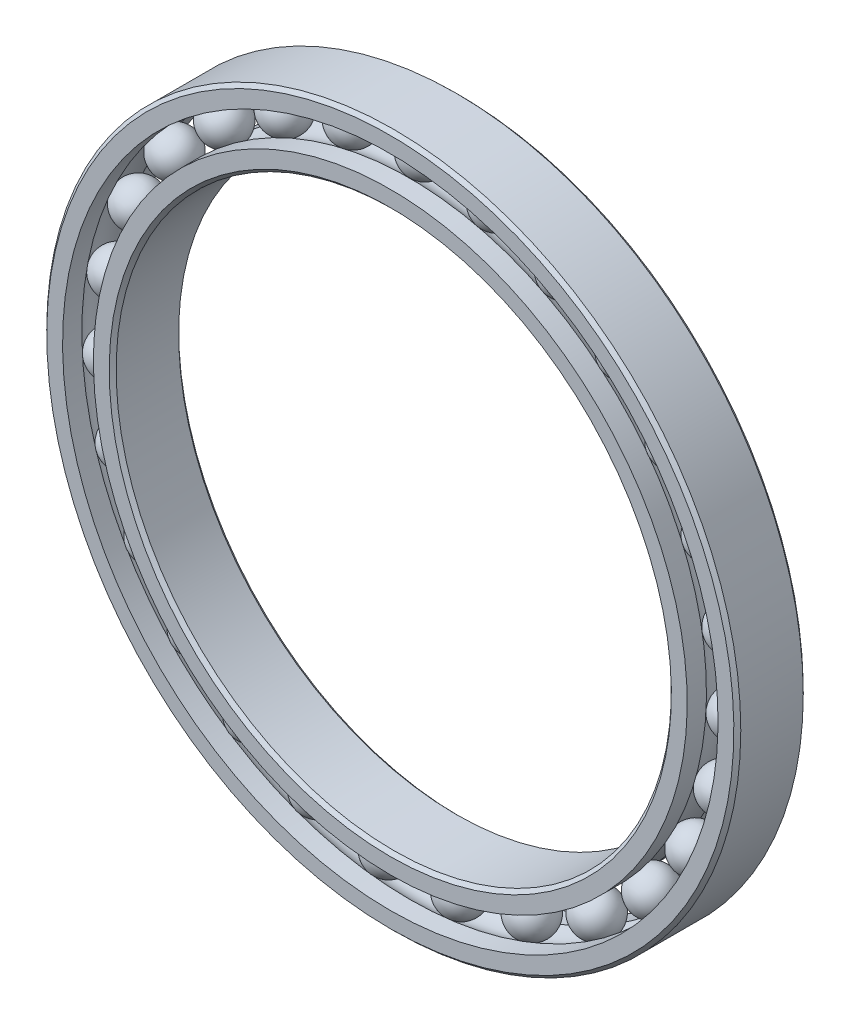
from build123d import *

# Parameters (mm, degrees)
CIRPATTERN1_COUNT = 27


with BuildPart() as part:
    # Sketch5 → Revolve1 (revolve)
    with BuildSketch(Plane(origin=(0, 0, 0), x_dir=(0, 0, -1), z_dir=(1, 0, 0)), mode=Mode.PRIVATE) as revolve1_sk:
        with BuildLine():
            Line((4.5, 50), (-4.5, 50))
            Line((-4.5, 50), (-5, 49.5))
            Line((-5, 49.5), (-5, 47.222222222))
            Line((-5, 47.222222222), (-2.222222222, 47.222222222))
            ThreePointArc((-2.222222222, 47.222222222), (0, 48.142696805), (2.222222222, 47.222222222))
            Line((2.222222222, 47.222222222), (5, 47.222222222))
            Line((5, 47.222222222), (5, 49.5))
            Line((5, 49.5), (4.5, 50))
        make_face()
    revolve(revolve1_sk.sketch.rotate(Axis((0, 0, 5), (0, 0, -1)), 180), axis=Axis((0, 0, 5), (0, 0, -1)))


with BuildPart() as body_2:
    # Sketch3 → Revolve3 (revolve)
    with BuildSketch(Plane(origin=(0, 0, 0), x_dir=(0, 0, -1), z_dir=(1, 0, 0)), mode=Mode.PRIVATE) as revolve3_sk:
        with BuildLine():
            Line((-5, 42.777777778), (-2.222222222, 42.777777778))
            ThreePointArc((-2.222222222, 42.777777778), (0, 41.857303195), (2.222222222, 42.777777778))
            Line((2.222222222, 42.777777778), (5, 42.777777778))
            Line((5, 42.777777778), (5, 40.5))
            Line((5, 40.5), (4.5, 40))
            Line((4.5, 40), (-4.5, 40))
            Line((-4.5, 40), (-5, 40.5))
            Line((-5, 40.5), (-5, 42.777777778))
        make_face()
    revolve(revolve3_sk.sketch.rotate(Axis((0, 0, 5), (0, 0, -1)), 180), axis=Axis((0, 0, 5), (0, 0, -1)))


with BuildPart() as body_3:
    # Sketch4 → Revolve4 (revolve)
    with BuildSketch(Plane(origin=(0, 0, 0), x_dir=(0, 0, -1), z_dir=(1, 0, 0))):
        with BuildLine():
            Line((-3.142696805, 45), (3.142696805, 45))
            ThreePointArc((3.142696805, 45), (0, 48.142696805), (-3.142696805, 45))
        make_face()
    revolve(axis=Axis((0, 45, 3.142696805), (0, 0, -1)))


with BuildPart() as cirpattern1_1:
    # CirPattern1: pattern copy
    add(body_3.part.rotate(Axis((0, 0, 0), (0, 0, 1)), 1 * 360 / CIRPATTERN1_COUNT))


with BuildPart() as cirpattern1_2:
    # CirPattern1: pattern copy
    add(body_3.part.rotate(Axis((0, 0, 0), (0, 0, 1)), 2 * 360 / CIRPATTERN1_COUNT))


with BuildPart() as cirpattern1_3:
    # CirPattern1: pattern copy
    add(body_3.part.rotate(Axis((0, 0, 0), (0, 0, 1)), 3 * 360 / CIRPATTERN1_COUNT))


with BuildPart() as cirpattern1_4:
    # CirPattern1: pattern copy
    add(body_3.part.rotate(Axis((0, 0, 0), (0, 0, 1)), 4 * 360 / CIRPATTERN1_COUNT))


with BuildPart() as cirpattern1_5:
    # CirPattern1: pattern copy
    add(body_3.part.rotate(Axis((0, 0, 0), (0, 0, 1)), 5 * 360 / CIRPATTERN1_COUNT))


with BuildPart() as cirpattern1_6:
    # CirPattern1: pattern copy
    add(body_3.part.rotate(Axis((0, 0, 0), (0, 0, 1)), 6 * 360 / CIRPATTERN1_COUNT))


with BuildPart() as cirpattern1_7:
    # CirPattern1: pattern copy
    add(body_3.part.rotate(Axis((0, 0, 0), (0, 0, 1)), 7 * 360 / CIRPATTERN1_COUNT))


with BuildPart() as cirpattern1_8:
    # CirPattern1: pattern copy
    add(body_3.part.rotate(Axis((0, 0, 0), (0, 0, 1)), 8 * 360 / CIRPATTERN1_COUNT))


with BuildPart() as cirpattern1_9:
    # CirPattern1: pattern copy
    add(body_3.part.rotate(Axis((0, 0, 0), (0, 0, 1)), 9 * 360 / CIRPATTERN1_COUNT))


with BuildPart() as cirpattern1_10:
    # CirPattern1: pattern copy
    add(body_3.part.rotate(Axis((0, 0, 0), (0, 0, 1)), 10 * 360 / CIRPATTERN1_COUNT))


with BuildPart() as cirpattern1_11:
    # CirPattern1: pattern copy
    add(body_3.part.rotate(Axis((0, 0, 0), (0, 0, 1)), 11 * 360 / CIRPATTERN1_COUNT))


with BuildPart() as cirpattern1_12:
    # CirPattern1: pattern copy
    add(body_3.part.rotate(Axis((0, 0, 0), (0, 0, 1)), 12 * 360 / CIRPATTERN1_COUNT))


with BuildPart() as cirpattern1_13:
    # CirPattern1: pattern copy
    add(body_3.part.rotate(Axis((0, 0, 0), (0, 0, 1)), 13 * 360 / CIRPATTERN1_COUNT))


with BuildPart() as cirpattern1_14:
    # CirPattern1: pattern copy
    add(body_3.part.rotate(Axis((0, 0, 0), (0, 0, 1)), 14 * 360 / CIRPATTERN1_COUNT))


with BuildPart() as cirpattern1_15:
    # CirPattern1: pattern copy
    add(body_3.part.rotate(Axis((0, 0, 0), (0, 0, 1)), 15 * 360 / CIRPATTERN1_COUNT))


with BuildPart() as cirpattern1_16:
    # CirPattern1: pattern copy
    add(body_3.part.rotate(Axis((0, 0, 0), (0, 0, 1)), 16 * 360 / CIRPATTERN1_COUNT))


with BuildPart() as cirpattern1_17:
    # CirPattern1: pattern copy
    add(body_3.part.rotate(Axis((0, 0, 0), (0, 0, 1)), 17 * 360 / CIRPATTERN1_COUNT))


with BuildPart() as cirpattern1_18:
    # CirPattern1: pattern copy
    add(body_3.part.rotate(Axis((0, 0, 0), (0, 0, 1)), 18 * 360 / CIRPATTERN1_COUNT))


with BuildPart() as cirpattern1_19:
    # CirPattern1: pattern copy
    add(body_3.part.rotate(Axis((0, 0, 0), (0, 0, 1)), 19 * 360 / CIRPATTERN1_COUNT))


with BuildPart() as cirpattern1_20:
    # CirPattern1: pattern copy
    add(body_3.part.rotate(Axis((0, 0, 0), (0, 0, 1)), 20 * 360 / CIRPATTERN1_COUNT))


with BuildPart() as cirpattern1_21:
    # CirPattern1: pattern copy
    add(body_3.part.rotate(Axis((0, 0, 0), (0, 0, 1)), 21 * 360 / CIRPATTERN1_COUNT))


with BuildPart() as cirpattern1_22:
    # CirPattern1: pattern copy
    add(body_3.part.rotate(Axis((0, 0, 0), (0, 0, 1)), 22 * 360 / CIRPATTERN1_COUNT))


with BuildPart() as cirpattern1_23:
    # CirPattern1: pattern copy
    add(body_3.part.rotate(Axis((0, 0, 0), (0, 0, 1)), 23 * 360 / CIRPATTERN1_COUNT))


with BuildPart() as cirpattern1_24:
    # CirPattern1: pattern copy
    add(body_3.part.rotate(Axis((0, 0, 0), (0, 0, 1)), 24 * 360 / CIRPATTERN1_COUNT))


with BuildPart() as cirpattern1_25:
    # CirPattern1: pattern copy
    add(body_3.part.rotate(Axis((0, 0, 0), (0, 0, 1)), 25 * 360 / CIRPATTERN1_COUNT))


with BuildPart() as cirpattern1_26:
    # CirPattern1: pattern copy
    add(body_3.part.rotate(Axis((0, 0, 0), (0, 0, 1)), 26 * 360 / CIRPATTERN1_COUNT))


solid = Compound([part.part, body_2.part, body_3.part, cirpattern1_1.part, cirpattern1_2.part, cirpattern1_3.part, cirpattern1_4.part, cirpattern1_5.part, cirpattern1_6.part, cirpattern1_7.part, cirpattern1_8.part, cirpattern1_9.part, cirpattern1_10.part, cirpattern1_11.part, cirpattern1_12.part, cirpattern1_13.part, cirpattern1_14.part, cirpattern1_15.part, cirpattern1_16.part, cirpattern1_17.part, cirpattern1_18.part, cirpattern1_19.part, cirpattern1_20.part, cirpattern1_21.part, cirpattern1_22.part, cirpattern1_23.part, cirpattern1_24.part, cirpattern1_25.part, cirpattern1_26.part])
